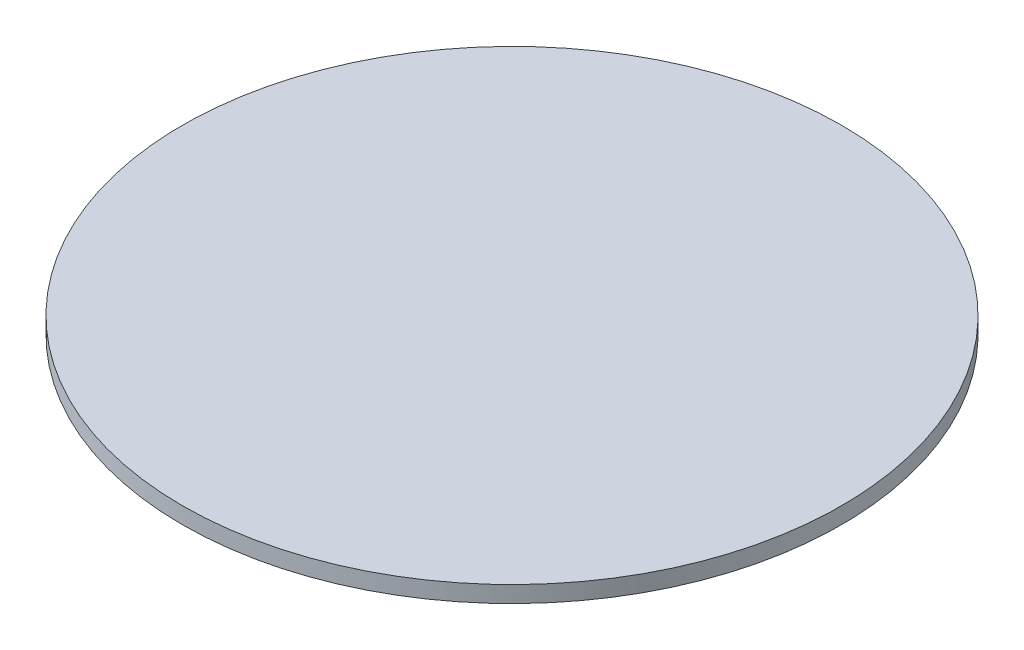
from build123d import *

# Parameters (mm, degrees)
SKETCH1_R           = 101.6
BOSS_EXTRUDE1_DEPTH = 2.54


with BuildPart() as part:
    # Sketch1 → Boss-Extrude1 (new, symmetric)
    with BuildSketch(Plane(origin=(0, 0, 0), x_dir=(1, 0, 0), z_dir=(0, 1, 0))):
        with Locations(Location((0, 0, 0), (0, 0, 270))):
            Circle(SKETCH1_R)
    extrude(amount=BOSS_EXTRUDE1_DEPTH, both=True)


solid = part.part
